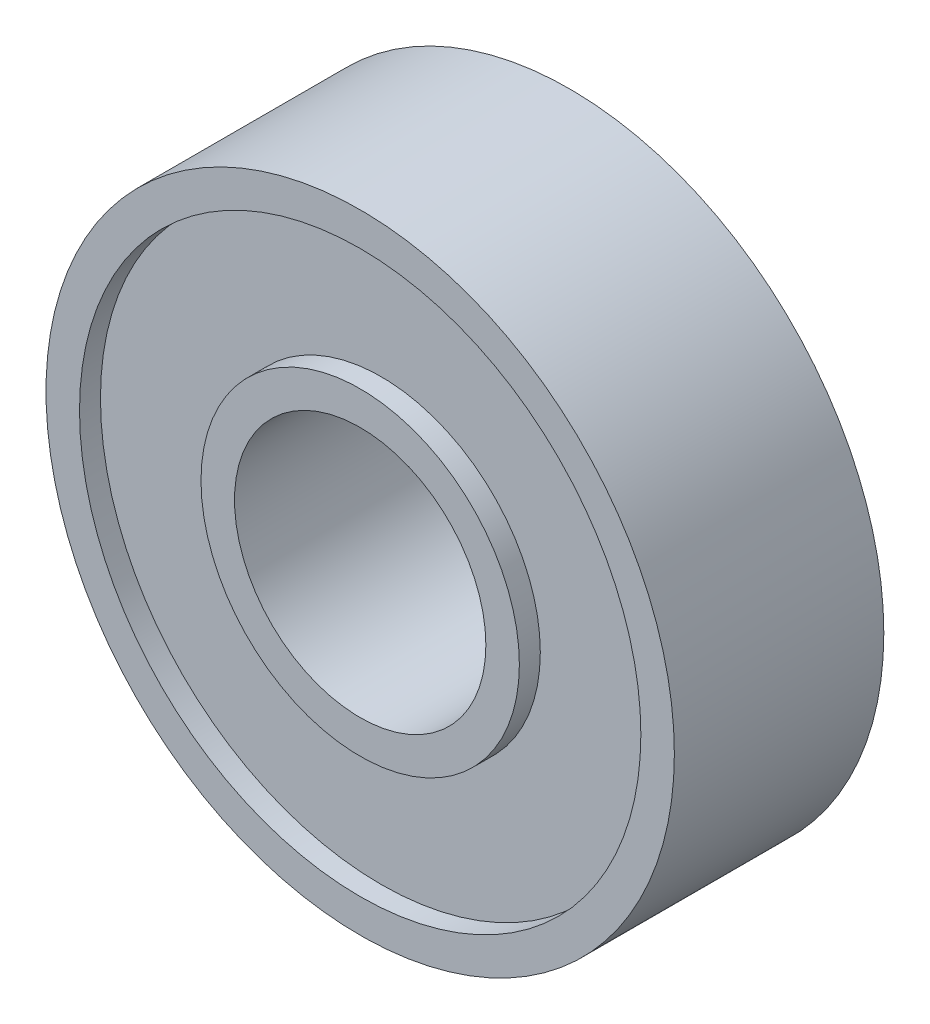
from build123d import *


with BuildPart() as part:
    # ｽｹｯﾁ1 → 回転1 (revolve)
    with BuildSketch(Plane(origin=(0, 0, 0), x_dir=(0, 0, -1), z_dir=(1, 0, 0)), mode=Mode.PRIVATE) as revolve_1_sk:
        Polygon((2.5, 7.5), (-2.5, 7.5), (-2.5, 6.7), (-2, 6.7), (-2, 3.8), (-2.5, 3.8), (-2.5, 3), (2.5, 3), (2.5, 3.8), (2, 3.8), (2, 6.7), (2.5, 6.7), align=None)
    revolve(revolve_1_sk.sketch.rotate(Axis((0, 0, 0), (0, 0, -1)), 90), axis=Axis((0, 0, 0), (0, 0, -1)))


solid = part.part
